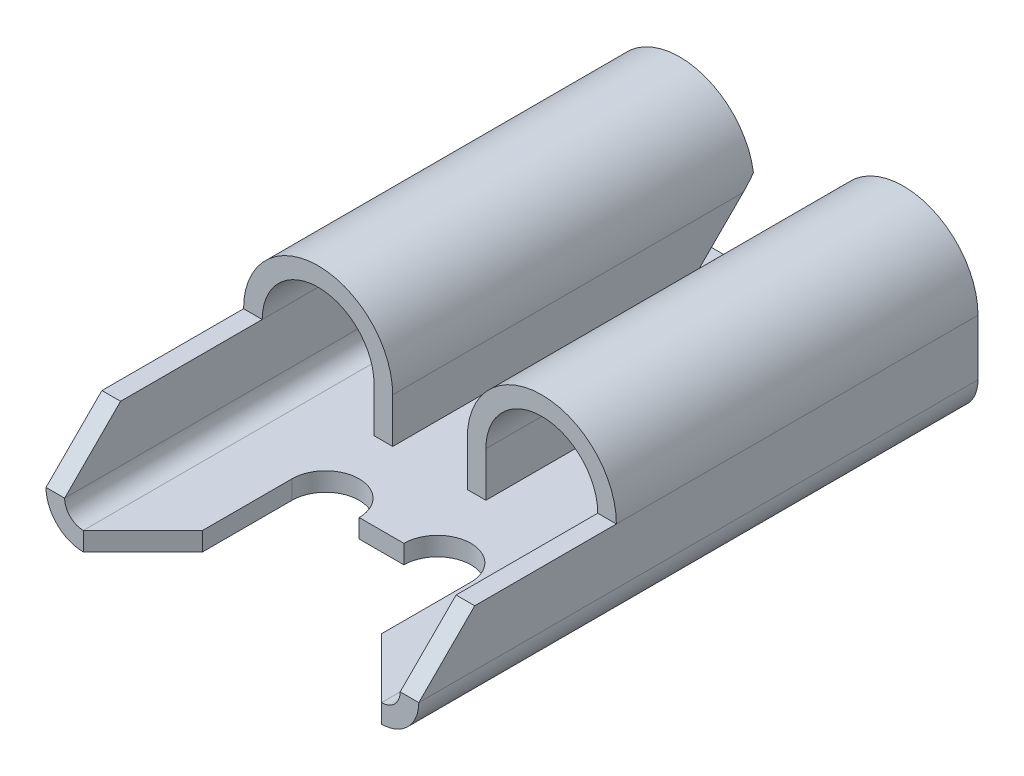
from build123d import *

# Parameters (mm, degrees)
BOSS_EXTRUDE1_DEPTH = 15
CUT_EXTRUDE1_DEPTH  = 17.439282223
CUT_EXTRUDE2_START  = -4.5
SKETCH3_W           = 10
SKETCH3_H           = 5.3
CUT_EXTRUDE2_DEPTH  = 2
SKETCH4_W           = 3
SKETCH4_H           = 0.815561475
CUT_EXTRUDE3_DEPTH  = 2
CHAMFER1_SIZE       = 1.5


with BuildPart() as part:
    # Sketch1 → Boss-Extrude1 (new body)
    with BuildSketch(Plane.XY):
        with BuildLine():
            Line((0, 0), (-4, 0))
            ThreePointArc((-4, 0), (-4.707106781, 0.292893219), (-5, 1))
            Line((-5, 1), (-5, 2.5))
            ThreePointArc((-5, 2.5), (-3, 4.5), (-1, 2.5))
            Line((-1, 2.5), (-1, 1.3))
            Line((-1, 1.3), (-1.5, 1.3))
            Line((-1.5, 1.3), (-1.5, 2.5))
            ThreePointArc((-1.5, 2.5), (-3, 4), (-4.5, 2.5))
            Line((-4.5, 2.5), (-4.5, 1))
            ThreePointArc((-4.5, 1), (-4.353553391, 0.646446609), (-4, 0.5))
            Line((-4, 0.5), (0, 0.5))
            Line((0, 0.5), (4, 0.5))
            ThreePointArc((4, 0.5), (4.353553391, 0.646446609), (4.5, 1))
            Line((4.5, 1), (4.5, 2.5))
            ThreePointArc((4.5, 2.5), (3, 4), (1.5, 2.5))
            Line((1.5, 2.5), (1.5, 1.3))
            Line((1.5, 1.3), (1, 1.3))
            Line((1, 1.3), (1, 2.5))
            ThreePointArc((1, 2.5), (3, 4.5), (5, 2.5))
            Line((5, 2.5), (5, 1))
            ThreePointArc((5, 1), (4.707106781, 0.292893219), (4, 0))
            Line((4, 0), (0, 0))
        make_face()
    extrude(amount=-BOSS_EXTRUDE1_DEPTH)

    # Sketch2 → Cut-Extrude1 (cut, through all)
    with BuildSketch(Plane.XZ):
        with BuildLine():
            Line((-4, 0), (-2.4, -1.6))
            Line((-2.4, -1.6), (-2.4, -4))
            ThreePointArc((-2.4, -4), (-1.5, -4.9), (-0.6, -4))
            Line((-0.6, -4), (0.6, -4))
            ThreePointArc((0.6, -4), (1.5, -4.9), (2.4, -4))
            Line((2.4, -4), (2.4, -1.6))
            Line((2.4, -1.6), (4, 0))
            Line((4, 0), (4, 0.537500588))
            Line((4, 0.537500588), (-4, 0.537500588))
            Line((-4, 0.537500588), (-4, 0))
        make_face()
    extrude(amount=-CUT_EXTRUDE1_DEPTH, mode=Mode.SUBTRACT)

    # Sketch3 → Cut-Extrude2 (cut)
    with BuildSketch(Plane.XZ.offset(CUT_EXTRUDE2_START)):
        with Locations((0, -2.65)):
            Rectangle(SKETCH3_W, SKETCH3_H)
    extrude(amount=CUT_EXTRUDE2_DEPTH, mode=Mode.SUBTRACT)

    # Sketch4 → Cut-Extrude3 (cut)
    with BuildSketch(Plane(origin=(0, 2.5, 0), x_dir=(1, 0, 0), z_dir=(0, 1, 0))):
        with Locations((0, 4.892219263)):
            Rectangle(SKETCH4_W, SKETCH4_H)
    extrude(amount=-CUT_EXTRUDE3_DEPTH, mode=Mode.SUBTRACT)

    # Chamfer1
    chamfer1_edges = [part.edges().sort_by_distance(p)[0] for p in [
        (4.75, 2.5, 0),
        (-4.75, 2.5, 0),
        (1.25, 1.3, -15),
        (-1.25, 1.3, -15),
    ]]
    chamfer(chamfer1_edges, length=CHAMFER1_SIZE)


solid = part.part
